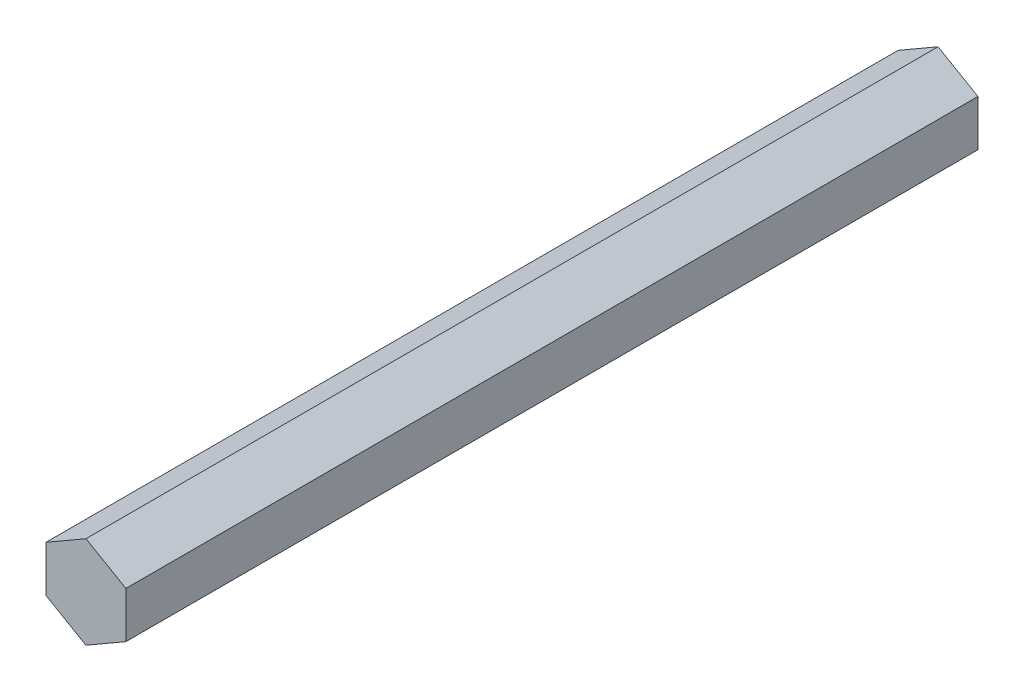
from build123d import *

# Parameters (mm, degrees)
BOSS_EXTRUDE1_DEPTH      = 50.8
BOSS_EXTRUDE1_DEPTH_BACK = 50.8


with BuildPart() as part:
    # Sketch3 → Boss-Extrude1 (new, two sides: drawn at the far end of the back side and taken through both)
    with BuildSketch(Plane.XY.offset(-BOSS_EXTRUDE1_DEPTH_BACK)):
        Polygon((0, 5.499261314), (-4.7625, 2.749630657), (-4.7625, -2.749630657), (0, -5.499261314), (4.7625, -2.749630657), (4.7625, 2.749630657), align=None)
    extrude(amount=BOSS_EXTRUDE1_DEPTH + BOSS_EXTRUDE1_DEPTH_BACK)


solid = part.part
